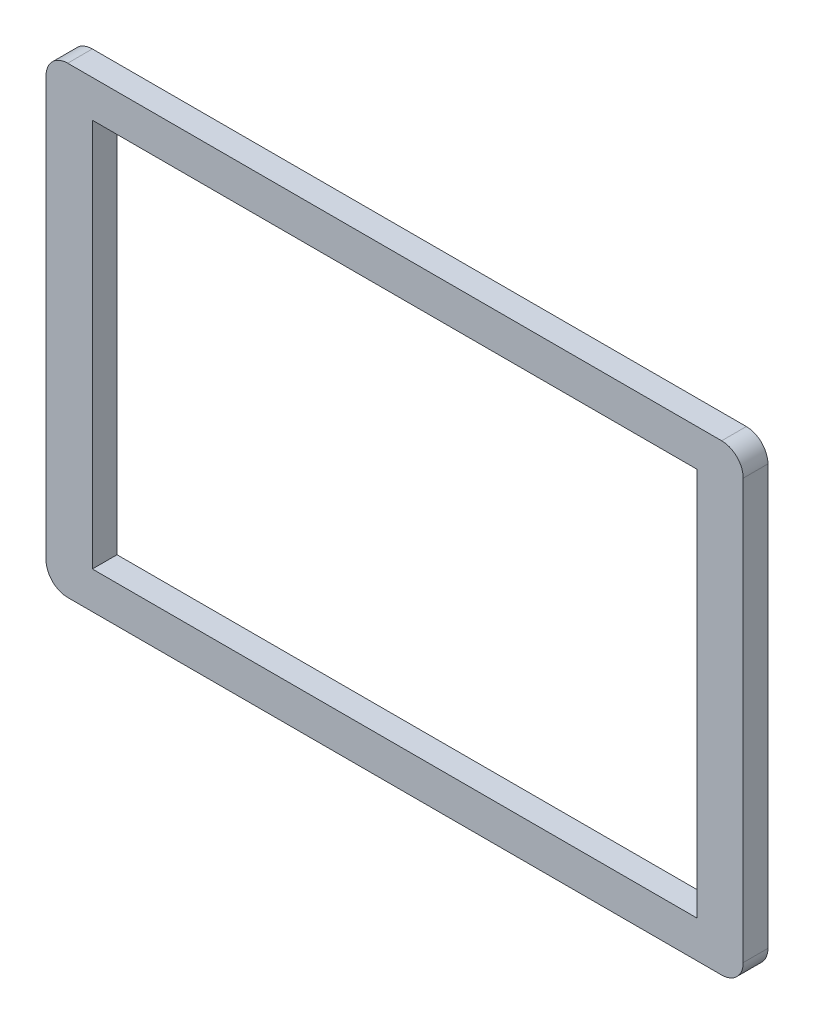
from build123d import *

# Parameters (mm, degrees)
SKETCH1_W           = 113
SKETCH1_H           = 75
SKETCH1_W_2         = 98
SKETCH1_H_2         = 63
BOSS_EXTRUDE1_DEPTH = 4
FILLET1_R           = 3.5


with BuildPart() as part:
    # Sketch1 → Boss-Extrude1 (new body)
    with BuildSketch(Plane.XY):
        with Locations((-26.020950744, 3.343078266)):
            Rectangle(SKETCH1_W, SKETCH1_H)
        with Locations((-26.020950744, 3.343078266)):
            Rectangle(SKETCH1_W_2, SKETCH1_H_2, mode=Mode.SUBTRACT)
    extrude(amount=BOSS_EXTRUDE1_DEPTH)

    # Fillet1
    fillet1_edges = [part.edges().sort_by_distance(p)[0] for p in [
        (-82.520950744, 40.843078266, 2),
        (30.479049256, 40.843078266, 2),
        (30.479049256, -34.156921734, 2),
        (-82.520950744, -34.156921734, 2),
    ]]
    fillet(fillet1_edges, radius=FILLET1_R)


solid = part.part
